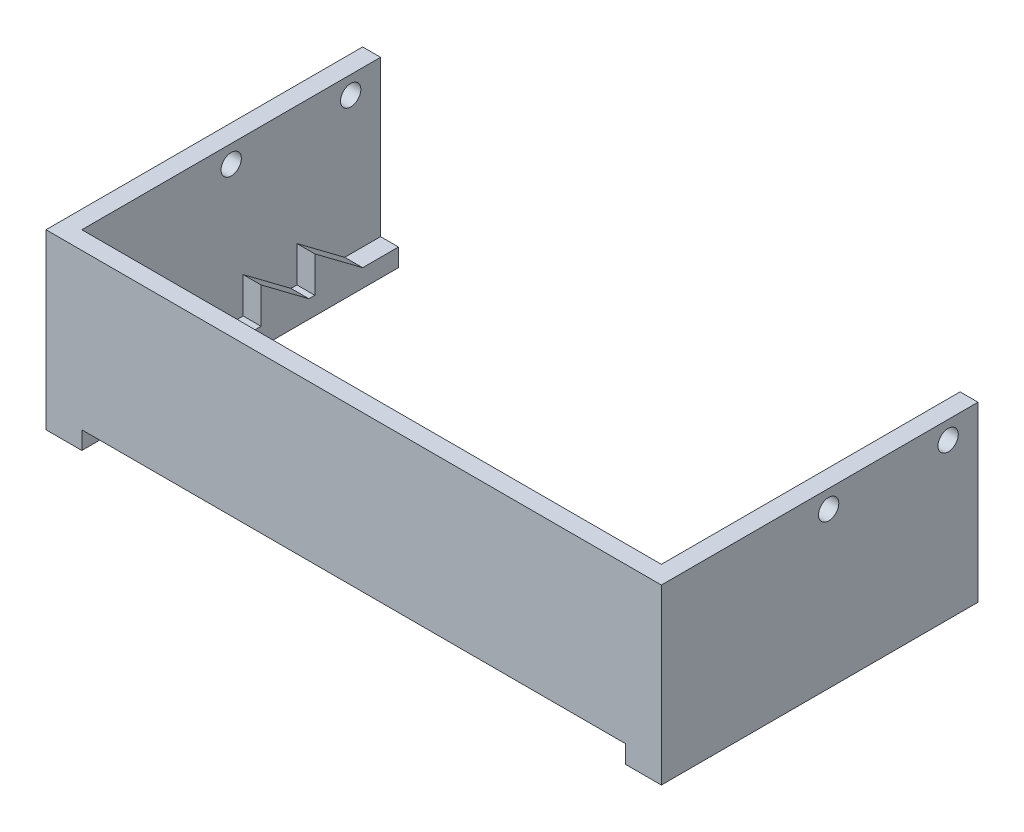
from build123d import *

# Parameters (mm, degrees)
SKETCH_1_W          = 50
SKETCH_1_H          = 26
EXTRUDE_1_DEPTH     = 3
EXTRUDE_2_DEPTH     = 6
SKETCH_5_W          = 0.1
SKETCH_5_H          = 0.1
CUT_EXTRUDE_1_DEPTH = 3
SKETCH_4_W          = 3
SKETCH_4_H          = 26
EXTRUDE_7_DEPTH     = 103
SKETCH_6_W          = 3
SKETCH_6_H          = 26
EXTRUDE_8_DEPTH     = 50
EXTRUDE_9_DEPTH     = 3
SKETCH_9_W          = 6
SKETCH_9_H          = 53
EXTRUDE_12_DEPTH    = 3
SKETCH_10_R         = 1.7
CUT_EXTRUDE_2_DEPTH = 108.930533215


with BuildPart() as part:
    # 草图1 → 凸台-拉伸1 (new body)
    with BuildSketch(Plane(origin=(0, 0, 0), x_dir=(0, 0, -1), z_dir=(1, 0, 0))):
        Rectangle(SKETCH_1_W, SKETCH_1_H)
    extrude(amount=EXTRUDE_1_DEPTH)

    # 草图2 → 凸台-拉伸2 (add)
    with BuildSketch(Plane(origin=(3, 0, 0), x_dir=(0, 0, -1), z_dir=(1, 0, 0))):
        Polygon((-25, -13), (-17, -13), (-17, -7), align=None)
        Polygon((-8, -7), (-16, -13), (-8, -13), align=None)
        Polygon((1, -7), (-7, -13), (1, -13), align=None)
        Polygon((10, -7), (2, -13), (10, -13), align=None)
        Polygon((19, -7), (11, -13), (19, -13), align=None)
    extrude(amount=-EXTRUDE_2_DEPTH)

    # 草图5 → 切除-拉伸1 (cut)
    with BuildSketch(Plane.ZY):
        with Locations((25, -13)):
            Rectangle(SKETCH_5_W, SKETCH_5_H)
    extrude(amount=CUT_EXTRUDE_1_DEPTH, mode=Mode.SUBTRACT)

    # 草图4 → 凸台-拉伸7 (add)
    with BuildSketch(Plane(origin=(3, 0, 0), x_dir=(0, 0, -1), z_dir=(1, 0, 0))):
        with Locations((-26.5, 0)):
            Rectangle(SKETCH_4_W, SKETCH_4_H)
    extrude(amount=-EXTRUDE_7_DEPTH)

    # 草图6 → 凸台-拉伸8 (add, through all)
    with BuildSketch(Plane(origin=(0, 0, 25), x_dir=(-1, 0, 0), z_dir=(0, 0, -1))):
        with Locations((98.5, 0)):
            Rectangle(SKETCH_6_W, SKETCH_6_H)
    extrude(amount=EXTRUDE_8_DEPTH)

    # 草图7 → 凸台-拉伸9 (add)
    with BuildSketch(Plane(origin=(-97, 0, 0), x_dir=(0, 0, -1), z_dir=(1, 0, 0))):
        Polygon((-25, -7), (-25, -13), (-17, -13), align=None)
        Polygon((-8, -13), (-16, -7), (-16, -13), align=None)
        Polygon((1, -13), (-7, -7), (-7, -13), align=None)
        Polygon((10, -13), (2, -7), (2, -13), align=None)
        Polygon((19, -13), (11, -7), (11, -13), align=None)
    extrude(amount=EXTRUDE_9_DEPTH)

    # 草图9 → 凸台-拉伸12 (add)
    with BuildSketch(Plane(origin=(0, -13, 0), x_dir=(-1, 0, 0), z_dir=(0, -1, 0))):
        with Locations((0, -1.5)):
            Rectangle(SKETCH_9_W, SKETCH_9_H)
        with Locations((97, -1.5)):
            Rectangle(SKETCH_9_W, SKETCH_9_H)
    extrude(amount=EXTRUDE_12_DEPTH)

    # 草图10 → 切除-拉伸2 (cut, through all)
    with BuildSketch(Plane(origin=(3, 0, 0), x_dir=(0, 0, -1), z_dir=(1, 0, 0))):
        with Locations((20, 10)):
            Circle(SKETCH_10_R)
        with Locations((0, 10)):
            Circle(SKETCH_10_R)
    extrude(amount=-CUT_EXTRUDE_2_DEPTH, mode=Mode.SUBTRACT)


solid = part.part
